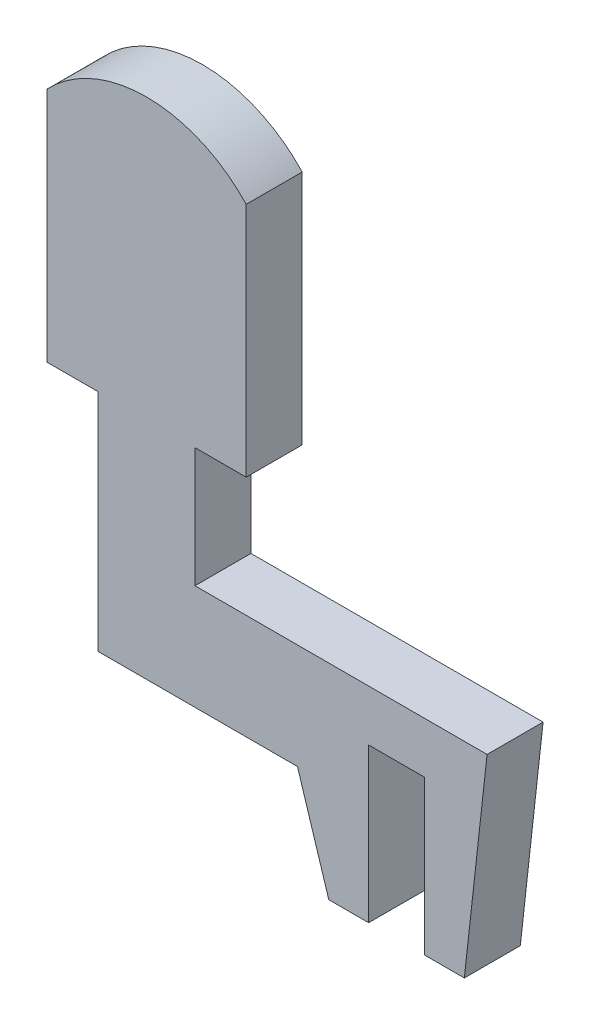
from build123d import *

# Parameters (mm, degrees)
BASE_EXTRUDE_DEPTH = 3


with BuildPart() as part:
    # Sketch1 → Base-Extrude (new body)
    with BuildSketch(Plane.XY):
        with BuildLine():
            Line((540.410759596, 46.36273023), (540.410759596, 39.95336404))
            Line((540.410759596, 39.95336404), (556.06264322, 39.95336404))
            Line((556.06264322, 39.95336404), (554.842233973, 28.969820695))
            Line((554.842233973, 28.969820695), (552.70789796, 28.969820695))
            Line((552.70789796, 28.969820695), (552.714937566, 37.219817691))
            Line((552.714937566, 37.219817691), (549.714937566, 37.219817691))
            Line((549.714937566, 37.219817691), (549.714937566, 28.969817691))
            Line((549.714937566, 28.969817691), (547.580602727, 28.972055819))
            Line((547.580602727, 28.972055819), (545.902566239, 34.311250108))
            Line((545.902566239, 34.311250108), (535.22410772, 34.311250108))
            Line((535.22410772, 34.311250108), (535.22410772, 46.36273023))
            Line((535.22410772, 46.36273023), (532.478204398, 46.36273023))
            Line((532.478204398, 46.36273023), (532.478204398, 46.515272643))
            Line((532.478204398, 46.515272643), (532.478204398, 59.024310063))
            ThreePointArc((532.478204398, 59.024310063), (537.817433658, 61.336415723), (543.156662918, 59.024310063))
            Line((543.156662918, 59.024310063), (543.156662918, 46.36273023))
            Line((543.156662918, 46.36273023), (540.410759596, 46.36273023))
        make_face()
    extrude(amount=BASE_EXTRUDE_DEPTH)


solid = part.part
